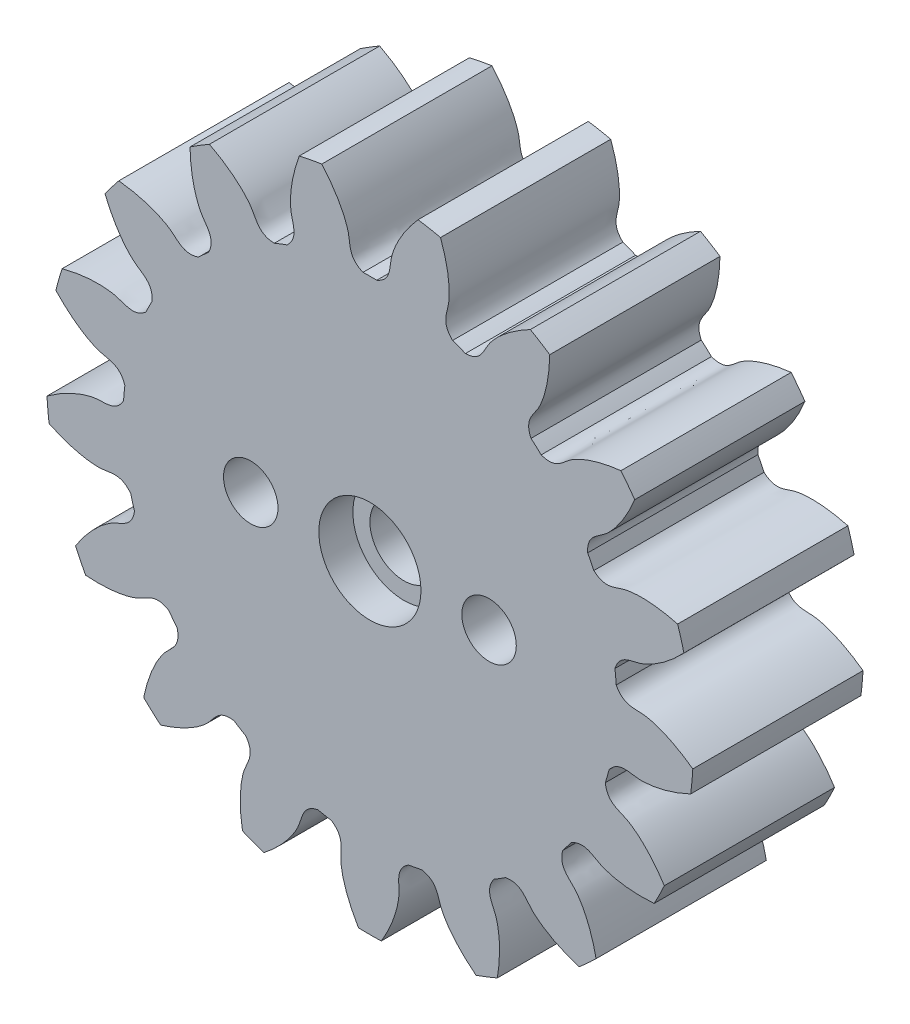
from build123d import *

# Parameters (mm, degrees)
SKETCH_1_R               = 19
EXTRUDE_1_DEPTH          = 10
CUT_EXTRUDE_1_DEPTH      = 29.670542374
PATTERN_CIRCULAR_1_COUNT = 17
SKETCH_4_R               = 1.6
SKETCH_4_R_2             = 2
CUT_EXTRUDE_2_DEPTH      = 29.650064525
SKETCH_5_R               = 3
CUT_EXTRUDE_3_DEPTH      = 2


with BuildPart() as part:
    # 草图1 → 凸台-拉伸1 (new body)
    with BuildSketch(Plane.XY):
        Circle(SKETCH_1_R)
    extrude(amount=EXTRUDE_1_DEPTH)

    # 草图2 → 切除-拉伸1 (cut, through all)
    with BuildSketch(Plane.XY):
        with BuildLine():
            ThreePointArc((0.403387494, 14.494387829), (0, 14.5), (-0.403387494, 14.494387829))
            add(Edge.make_bspline(
                [(-0.403387494, 14.494387829), (-1.255759481, 14.849644042), (-1.132390756, 15.509626813), (-1.276611209, 16.129648275), (-1.289951469, 16.18230119), (-1.306037005, 16.240838627), (-1.32510118, 16.305170665), (-1.347383555, 16.375198727), (-1.373118159, 16.450817515), (-1.40253689, 16.531914502), (-1.435868224, 16.618370188), (-1.473337358, 16.710058129), (-1.515165928, 16.80684504), (-1.561571855, 16.908590882), (-1.612769151, 17.015148962), (-1.66896775, 17.12636603), (-1.730373323, 17.242082389), (-1.797187111, 17.362132), (-1.869605751, 17.4863426), (-1.947821109, 17.61453582), (-2.032020115, 17.746527309), (-2.1223846, 17.882126855), (-2.219091138, 18.021138524), (-2.32231089, 18.163360791), (-2.432209452, 18.308586678), (-2.548946705, 18.456603899), (-2.67267667, 18.607195006), (-2.803547366, 18.760137539), (-2.941700674, 18.915204179), (-3.087272199, 19.072162909), (-3.24039114, 19.23077717), (-3.401180166, 19.390806026), (-3.569755292, 19.552004336), (-3.746225758, 19.71412292), (-3.930693918, 19.876908731), (-4.123255131, 20.040105038), (-4.323997649, 20.203451599), (-4.533002522, 20.366684847), (-4.750343497, 20.529538073), (-4.976086928, 20.691741613), (-5.210291694, 20.853023038), (-5.453009069, 21.013107349), (-5.79164327, 21.226861067), (-6.053153804, 21.381051942), (-6.231291666, 21.481438237)],
                knots=[0, 0, 0, 0, 0.193882922, 0.199023975, 0.204850501, 0.211362501, 0.218559975, 0.226442923, 0.235011345, 0.24426524, 0.254204608, 0.264829451, 0.276139767, 0.288135557, 0.300816821, 0.314183558, 0.328235769, 0.342973453, 0.358396612, 0.374505244, 0.39129935, 0.408778929, 0.426943982, 0.445794509, 0.46533051, 0.485551984, 0.506458932, 0.528051354, 0.550329249, 0.573292619, 0.596941461, 0.621275778, 0.646295568, 0.672000832, 0.69839157, 0.725467781, 0.753229466, 0.781676625, 0.810809257, 0.840627364, 0.871130943, 0.902319997, 0.934194524, 1, 1, 1, 1], degree=3))
            ThreePointArc((-6.231291666, 21.481438237), (0, 22.366966369), (6.231291666, 21.481438237))
            add(Edge.make_bspline(
                [(0.403387494, 14.494387829), (1.255759481, 14.849644042), (1.132390756, 15.509626813), (1.276611209, 16.129648275), (1.289951469, 16.18230119), (1.306037005, 16.240838627), (1.32510118, 16.305170665), (1.347383555, 16.375198727), (1.373118159, 16.450817515), (1.40253689, 16.531914502), (1.435868224, 16.618370188), (1.473337358, 16.710058129), (1.515165928, 16.80684504), (1.561571855, 16.908590882), (1.612769151, 17.015148962), (1.66896775, 17.12636603), (1.730373323, 17.242082389), (1.797187111, 17.362132), (1.869605751, 17.4863426), (1.947821109, 17.61453582), (2.032020115, 17.746527309), (2.1223846, 17.882126855), (2.219091138, 18.021138524), (2.32231089, 18.163360791), (2.432209452, 18.308586678), (2.548946705, 18.456603899), (2.67267667, 18.607195006), (2.803547366, 18.760137539), (2.941700674, 18.915204179), (3.087272199, 19.072162909), (3.24039114, 19.23077717), (3.401180166, 19.390806026), (3.569755292, 19.552004336), (3.746225758, 19.71412292), (3.930693918, 19.876908731), (4.123255131, 20.040105038), (4.323997649, 20.203451599), (4.533002522, 20.366684847), (4.750343497, 20.529538073), (4.976086928, 20.691741613), (5.210291694, 20.853023038), (5.453009069, 21.013107349), (5.79164327, 21.226861067), (6.053153804, 21.381051942), (6.231291666, 21.481438237)],
                knots=[0, 0, 0, 0, 0.193882922, 0.199023975, 0.204850501, 0.211362501, 0.218559975, 0.226442923, 0.235011345, 0.24426524, 0.254204608, 0.264829451, 0.276139767, 0.288135557, 0.300816821, 0.314183558, 0.328235769, 0.342973453, 0.358396612, 0.374505244, 0.39129935, 0.408778929, 0.426943982, 0.445794509, 0.46533051, 0.485551984, 0.506458932, 0.528051354, 0.550329249, 0.573292619, 0.596941461, 0.621275778, 0.646295568, 0.672000832, 0.69839157, 0.725467781, 0.753229466, 0.781676625, 0.810809257, 0.840627364, 0.871130943, 0.902319997, 0.934194524, 1, 1, 1, 1], degree=3))
        make_face()
    cut_extrude_1 = extrude(amount=CUT_EXTRUDE_1_DEPTH, mode=Mode.SUBTRACT)

    # 阵列(圆周)1: 切除-拉伸1 ×17 about axis
    pattern_circular_1_axis = Axis((0, 0, -0.25), (0, 0, 1))
    for i in range(1, PATTERN_CIRCULAR_1_COUNT):
        add(cut_extrude_1.rotate(pattern_circular_1_axis, i * 360 / PATTERN_CIRCULAR_1_COUNT), mode=Mode.SUBTRACT)

    # 草图4 → 切除-拉伸2 (cut, through all)
    with BuildSketch(Plane.XY.offset(10)):
        with Locations((7, 0)):
            Circle(SKETCH_4_R)
        with Locations((-7, 0)):
            Circle(SKETCH_4_R)
        Circle(SKETCH_4_R_2)
    extrude(amount=-CUT_EXTRUDE_2_DEPTH, mode=Mode.SUBTRACT)

    # 草图5 → 切除-拉伸3 (cut)
    with BuildSketch(Plane.XY.offset(10)):
        Circle(SKETCH_5_R)
    extrude(amount=-CUT_EXTRUDE_3_DEPTH, mode=Mode.SUBTRACT)


solid = part.part
